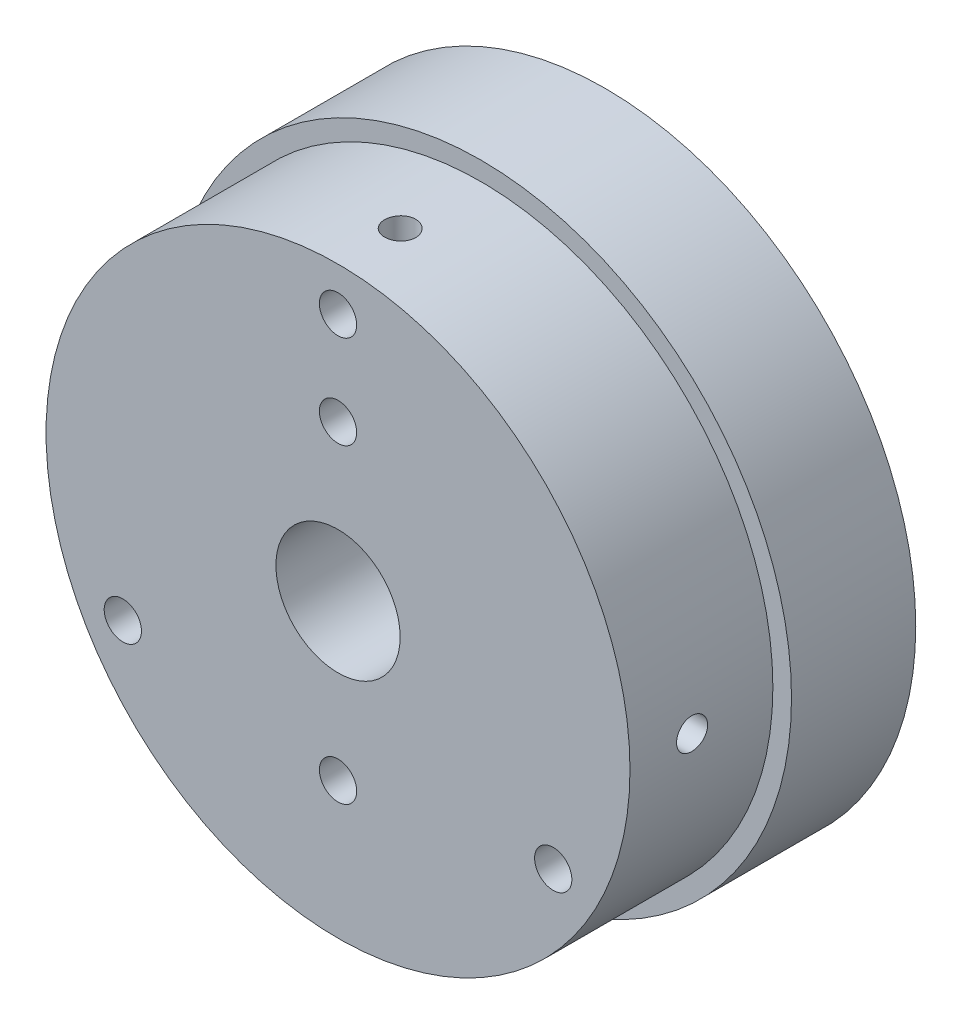
from build123d import *

# Parameters (mm, degrees)
SKETCH1_R           = 50
BOSS_EXTRUDE1_DEPTH = 20
SKETCH2_R           = 47
BOSS_EXTRUDE2_DEPTH = 23
SKETCH3_R           = 3
SKETCH3_R_2         = 10
CUT_EXTRUDE1_DEPTH  = 83.758685345
SKETCH5_R           = 2.5
CUT_EXTRUDE3_DEPTH  = 25
CIRPATTERN1_COUNT   = 4


with BuildPart() as part:
    # Sketch1 → Boss-Extrude1 (new body)
    with BuildSketch(Plane.XY):
        Circle(SKETCH1_R)
    extrude(amount=BOSS_EXTRUDE1_DEPTH)

    # Sketch2 → Boss-Extrude2 (add)
    with BuildSketch(Plane.XY.offset(20)):
        Circle(SKETCH2_R)
    extrude(amount=BOSS_EXTRUDE2_DEPTH)

    # Sketch3 → Cut-Extrude1 (cut, through all)
    with BuildSketch(Plane.XY.offset(43)):
        with Locations((0, 40)):
            Circle(SKETCH3_R)
        with Locations((34.641016151, -20)):
            Circle(SKETCH3_R)
        with Locations((-34.641016151, -20)):
            Circle(SKETCH3_R)
        with Locations((0, -25)):
            Circle(SKETCH3_R)
        with Locations((0, 25)):
            Circle(SKETCH3_R)
        Circle(SKETCH3_R_2)
    extrude(amount=-CUT_EXTRUDE1_DEPTH, mode=Mode.SUBTRACT)

    # Sketch5 → Cut-Extrude3 (cut)
    with BuildSketch(Plane.ZY.offset(-50)):
        with Locations((33, 0)):
            Circle(SKETCH5_R)
    cut_extrude3 = extrude(amount=CUT_EXTRUDE3_DEPTH, mode=Mode.SUBTRACT)

    # CirPattern1: Cut-Extrude3 ×4 about axis
    cirpattern1_axis = Axis((0, 0, 43), (0, 0, -1))
    for i in range(1, CIRPATTERN1_COUNT):
        add(cut_extrude3.rotate(cirpattern1_axis, i * 360 / CIRPATTERN1_COUNT), mode=Mode.SUBTRACT)


solid = part.part
